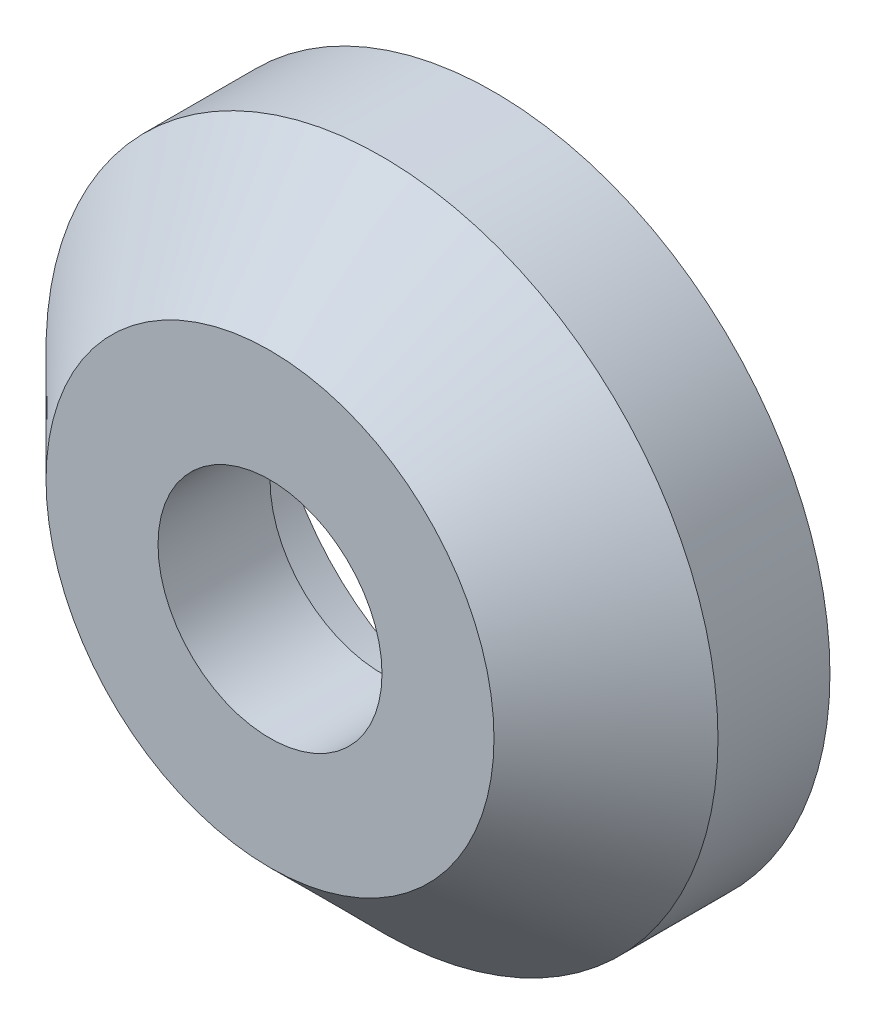
from build123d import *

# Parameters (mm, degrees)
SKETCH1_R           = 7.5
SKETCH1_R_2         = 2.5
BOSS_EXTRUDE1_DEPTH = 5
CHAMFER1_SIZE       = 2.5
SKETCH2_R           = 5
CUT_EXTRUDE1_DEPTH  = 2.5


with BuildPart() as part:
    # Sketch1 → Boss-Extrude1 (new body)
    with BuildSketch(Plane.XY):
        Circle(SKETCH1_R)
        Circle(SKETCH1_R_2, mode=Mode.SUBTRACT)
    extrude(amount=BOSS_EXTRUDE1_DEPTH)

    # Chamfer1
    chamfer1_edges = [part.edges().sort_by_distance(p)[0] for p in [
        (-7.5, 0, 5),
    ]]
    chamfer(chamfer1_edges, length=CHAMFER1_SIZE)

    # Sketch2 → Cut-Extrude1 (cut)
    with BuildSketch(Plane(origin=(0, 0, 0), x_dir=(-1, 0, 0), z_dir=(0, 0, -1))):
        Circle(SKETCH2_R)
    extrude(amount=-CUT_EXTRUDE1_DEPTH, mode=Mode.SUBTRACT)


solid = part.part
